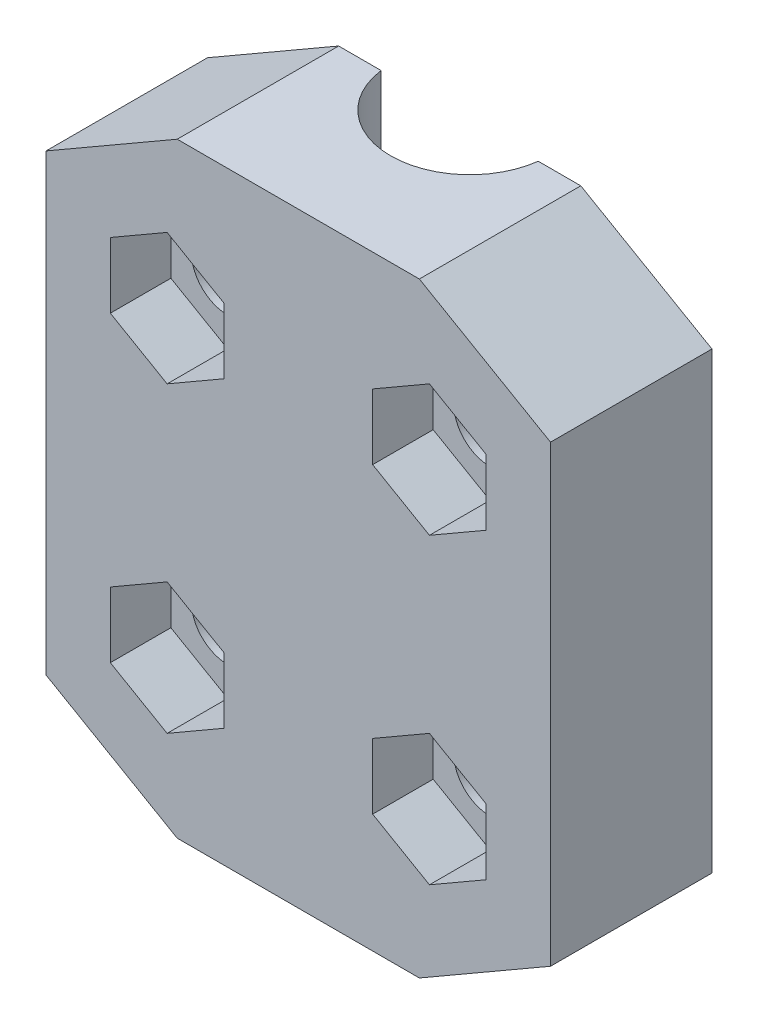
from build123d import *

# Parameters (mm, degrees)
SCHIZZO1_R         = 1.8
MAIN_BODY_DEPTH    = 8
SCHIZZO2_R         = 3.925
THREADED_ROD_DEPTH = 15
SCHIZZO4_R         = 3.4325
MOTOR_SHAFT_DEPTH  = 15
NUT_RECESS_DEPTH   = 3


with BuildPart() as part:
    # Schizzo1 → Main Body (new body)
    with BuildSketch(Plane.XY):
        Polygon((12.5, -11.24722325), (12.5, 11.24722325), (6, 15), (-6, 15), (-12.5, 11.24722325), (-12.5, -11.24722325), (-6, -15), (6, -15), align=None)
        with Locations((-6.5, 7.5)):
            Circle(SCHIZZO1_R, mode=Mode.SUBTRACT)
        with Locations((6.5, -7.5)):
            Circle(SCHIZZO1_R, mode=Mode.SUBTRACT)
        with Locations(Location((-6.5, -7.5, 0), (0, 0, 180))):
            Circle(SCHIZZO1_R, mode=Mode.SUBTRACT)
        with Locations(Location((6.5, 7.5, 0), (0, 0, 180))):
            Circle(SCHIZZO1_R, mode=Mode.SUBTRACT)
    extrude(amount=MAIN_BODY_DEPTH)

    # Schizzo2 → Threaded rod (cut)
    with BuildSketch(Plane(origin=(0, 15, 0), x_dir=(1, 0, 0), z_dir=(0, 1, 0))):
        with Locations((0, 0.5)):
            Circle(SCHIZZO2_R)
    extrude(amount=-THREADED_ROD_DEPTH, mode=Mode.SUBTRACT)

    # Schizzo4 → Motor shaft (cut)
    with BuildSketch(Plane.XZ.offset(15)):
        with Locations((0, -0.5)):
            Circle(SCHIZZO4_R)
    extrude(amount=-MOTOR_SHAFT_DEPTH, mode=Mode.SUBTRACT)

    # Schizzo5 → Nut recess (cut)
    with BuildSketch(Plane.XY.offset(8)):
        Polygon((-9.314582562, -5.875), (-6.5, -4.25), (-3.685417438, -5.875), (-3.685417438, -9.125), (-6.5, -10.75), (-9.314582562, -9.125), align=None)
        Polygon((6.5, -4.25), (3.685417438, -5.875), (3.685417438, -9.125), (6.5, -10.75), (9.314582562, -9.125), (9.314582562, -5.875), align=None)
        Polygon((-6.5, 4.25), (-3.685417438, 5.875), (-3.685417438, 9.125), (-6.5, 10.75), (-9.314582562, 9.125), (-9.314582562, 5.875), align=None)
        Polygon((9.314582562, 5.875), (6.5, 4.25), (3.685417438, 5.875), (3.685417438, 9.125), (6.5, 10.75), (9.314582562, 9.125), align=None)
    extrude(amount=-NUT_RECESS_DEPTH, mode=Mode.SUBTRACT)


solid = part.part
